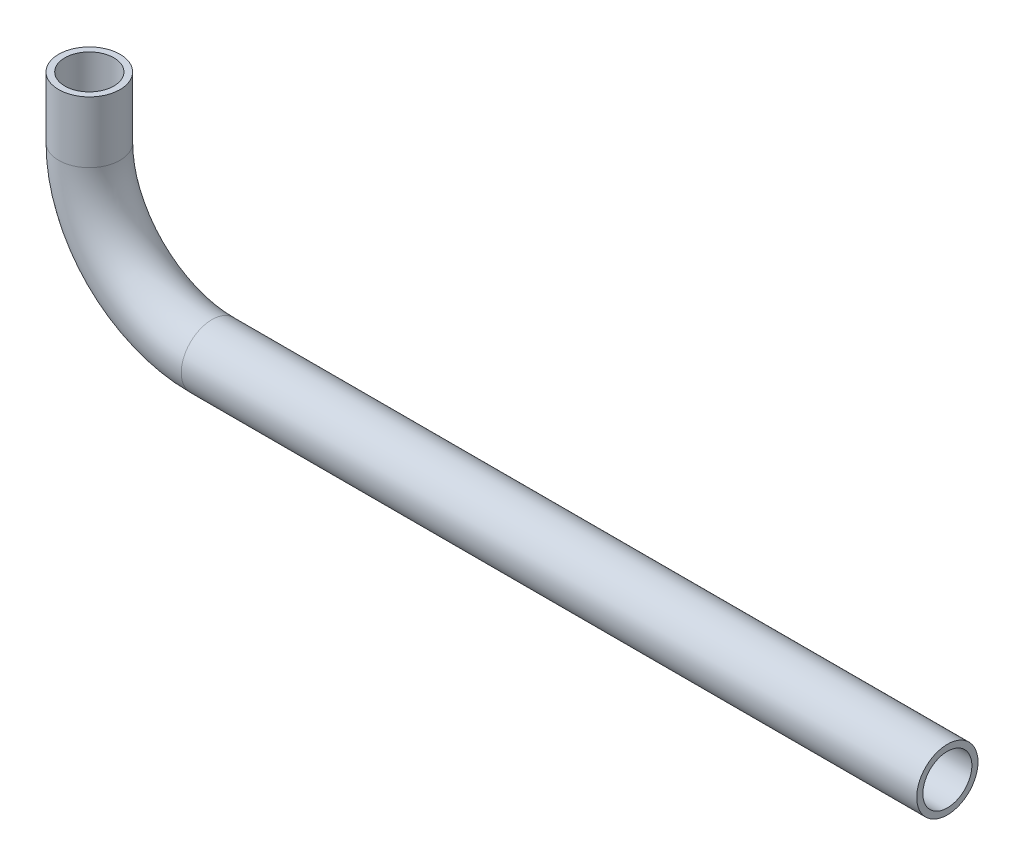
from build123d import *

# Parameters (mm, degrees)
SWEEP_THIN1_PROFILE_R   = 5
SWEEP_THIN1_PROFILE_R_2 = 4


with BuildPart() as part:
    # Sweep-Thin1: sweep along a path in Sketch1
    with BuildLine(Plane.XY) as sweep_thin1_path:
        Line((120, 0), (0, 0))
        ThreePointArc((0, 0), (-14.142135624, 5.857864376), (-20, 20))
        Line((-20, 20), (-20, 30))
    # Sweep-Thin1 profile (on start of the path) → Sweep-Thin1 (sweep)
    with BuildSketch(Plane(origin=(120, 0, 0), x_dir=(0, 0, -1), z_dir=(-1, 0, 0))):
        Circle(SWEEP_THIN1_PROFILE_R)
        Circle(SWEEP_THIN1_PROFILE_R_2, mode=Mode.SUBTRACT)
    sweep(path=sweep_thin1_path.line)


solid = part.part
